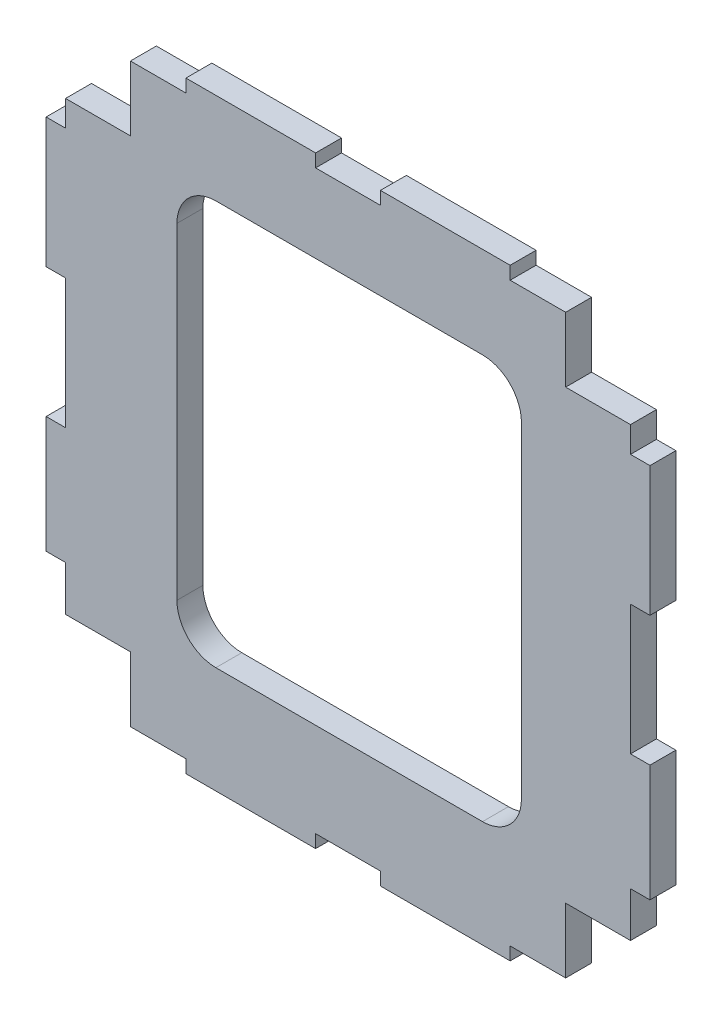
from build123d import *

# Parameters (mm, degrees)
EXTRUDE_1_DEPTH = 2


with BuildPart() as part:
    # Model → 凸台-拉伸1 (new body)
    with BuildSketch(Plane.XY):
        Polygon((31.698795353, 52.657311482), (35.978795353, 52.657311482), (35.978795353, 53.657667188), (45.978795353, 53.657667188), (45.978795353, 52.657311482), (50.978795353, 52.657311482), (50.978795353, 53.657667188), (60.978795353, 53.657667188), (60.978795353, 52.657311482), (65.258795353, 52.657311482), (65.258795353, 47.657311482), (70.258795353, 47.657311482), (70.258795353, 45.667311482), (71.758795353, 45.667311482), (71.758795353, 35.667311482), (70.258795353, 35.667311482), (70.258795353, 25.667311482), (71.758795353, 25.667311482), (71.758795353, 16.667311482), (70.258795353, 16.667311482), (70.258795353, 15.517311482), (70.258795353, 13.201678386), (65.258795353, 13.201678386), (65.258795353, 8.201678386), (60.978795353, 8.201678386), (60.978795353, 7.20132268), (50.978795353, 7.20132268), (50.978795353, 8.201678386), (45.978795353, 8.201678386), (45.978795353, 7.20132268), (35.978795353, 7.20132268), (35.978795353, 8.201678386), (31.698795353, 8.201678386), (31.698795353, 13.201678386), (26.698795353, 13.201678386), (26.698795353, 15.517311482), (26.698795353, 16.667311482), (25.198795353, 16.667311482), (25.198795353, 25.667311482), (26.698795353, 25.667311482), (26.698795353, 35.667311482), (25.198795353, 35.667311482), (25.198795353, 45.667311482), (26.698795353, 45.667311482), (26.698795353, 47.657311482), (31.698795353, 47.657311482), align=None)
        with BuildLine():
            Line((58.847883072, 46.60843734), (38.287883072, 46.60843734))
            ThreePointArc((38.287883072, 46.60843734), (36.166562728, 45.729757683), (35.287883072, 43.60843734))
            Line((35.287883072, 43.60843734), (35.287883072, 18.43843734))
            ThreePointArc((35.287883072, 18.43843734), (36.166562728, 16.317116996), (38.287883072, 15.43843734))
            Line((38.287883072, 15.43843734), (58.847883072, 15.43843734))
            ThreePointArc((58.847883072, 15.43843734), (60.969203415, 16.317116996), (61.847883072, 18.43843734))
            Line((61.847883072, 18.43843734), (61.847883072, 43.60843734))
            ThreePointArc((61.847883072, 43.60843734), (60.969203415, 45.729757683), (58.847883072, 46.60843734))
        make_face(mode=Mode.SUBTRACT)
    extrude(amount=EXTRUDE_1_DEPTH)


solid = part.part
